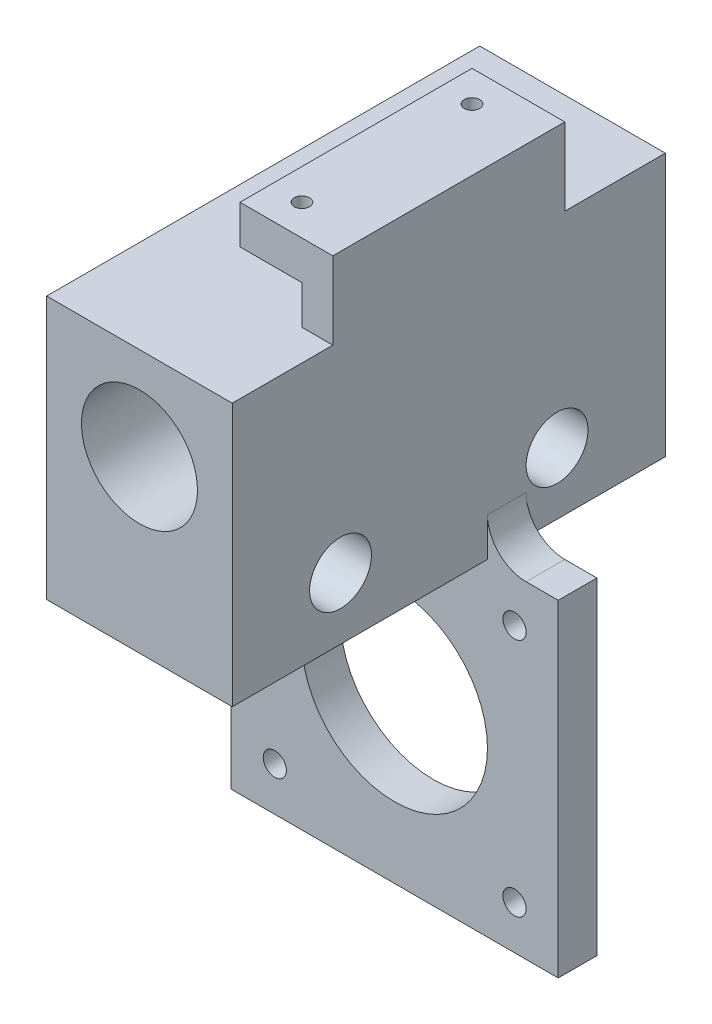
from build123d import *

# Parameters (mm, degrees)
SKETCH1_W           = 24
SKETCH1_H           = 34
SKETCH1_R           = 7.5
BOSS_EXTRUDE1_DEPTH = 28
SKETCH5_W           = 12
SKETCH5_H           = 30
BOSS_EXTRUDE3_DEPTH = 10
SKETCH6_W           = 8
SKETCH6_H           = 5
CUT_EXTRUDE3_DEPTH  = 50.769468553
CUT_EXTRUDE4_REACH  = 55.516
SKETCH7_R           = 1
SKETCH8_R           = 4
CUT_EXTRUDE5_DEPTH  = 20
SKETCH9_W           = 42.3
SKETCH9_H           = 5
BOSS_EXTRUDE4_DEPTH = 42.3
SKETCH10_R          = 12
SKETCH10_R_2        = 1.5
CUT_EXTRUDE6_DEPTH  = 48
FILLET1_R           = 5
FILLET2_R           = 5


with BuildPart() as part:
    # Sketch1 → Boss-Extrude1 (new, symmetric)
    with BuildSketch(Plane.XY):
        with Locations((0, -5)):
            Rectangle(SKETCH1_W, SKETCH1_H)
        Circle(SKETCH1_R, mode=Mode.SUBTRACT)
    extrude(amount=BOSS_EXTRUDE1_DEPTH, both=True)

    # Sketch5 → Boss-Extrude3 (add)
    with BuildSketch(Plane(origin=(0, 12, 0), x_dir=(1, 0, 0), z_dir=(0, 1, 0))):
        with Locations((6, 0)):
            Rectangle(SKETCH5_W, SKETCH5_H)
    extrude(amount=BOSS_EXTRUDE3_DEPTH)

    # Sketch6 → Cut-Extrude3 (cut, through all)
    with BuildSketch(Plane.XY.offset(15)):
        with Locations((4, 14.5)):
            Rectangle(SKETCH6_W, SKETCH6_H)
    extrude(amount=-CUT_EXTRUDE3_DEPTH, mode=Mode.SUBTRACT)

    # Sketch7 → Cut-Extrude4 (cut, up to next)
    with BuildSketch(Plane(origin=(0, 22, 0), x_dir=(1, 0, 0), z_dir=(0, 1, 0)), mode=Mode.PRIVATE) as cut_extrude4_sk1:
        with Locations(Location((4, 11, 0), (0, 0, 270))):
            Circle(SKETCH7_R)
    cut_extrude4_tool1 = extrude(cut_extrude4_sk1.sketch, amount=-CUT_EXTRUDE4_REACH, mode=Mode.PRIVATE) & part.part
    # Sketch7 → Cut-Extrude4 (cut, up to next)
    with BuildSketch(Plane(origin=(0, 22, 0), x_dir=(1, 0, 0), z_dir=(0, 1, 0)), mode=Mode.PRIVATE) as cut_extrude4_sk2:
        with Locations(Location((4, -11, 0), (0, 0, 270))):
            Circle(SKETCH7_R)
    cut_extrude4_tool2 = extrude(cut_extrude4_sk2.sketch, amount=-CUT_EXTRUDE4_REACH, mode=Mode.PRIVATE) & part.part
    add(cut_extrude4_tool1.solids().sort_by_distance((4, 22, -11))[0], mode=Mode.SUBTRACT)
    add(cut_extrude4_tool2.solids().sort_by_distance((4, 22, 11))[0], mode=Mode.SUBTRACT)

    # Sketch8 → Cut-Extrude5 (cut)
    with BuildSketch(Plane(origin=(12, 0, 0), x_dir=(0, 0, -1), z_dir=(1, 0, 0))):
        with Locations(Location((-14, -14, 0), (0, 0, 90))):
            Circle(SKETCH8_R)
        with Locations(Location((14, -14, 0), (0, 0, 90))):
            Circle(SKETCH8_R)
    extrude(amount=-CUT_EXTRUDE5_DEPTH, mode=Mode.SUBTRACT)

    # Sketch9 → Boss-Extrude4 (add)
    with BuildSketch(Plane.XZ.offset(22)):
        with Locations((0, -7.5)):
            Rectangle(SKETCH9_W, SKETCH9_H)
    extrude(amount=BOSS_EXTRUDE4_DEPTH)

    # Sketch10 → Cut-Extrude6 (cut)
    with BuildSketch(Plane(origin=(0, 0, -10), x_dir=(-1, 0, 0), z_dir=(0, 0, -1))):
        with Locations((0, -43.15)):
            Circle(SKETCH10_R)
        with Locations((-15.5, -27.65)):
            Circle(SKETCH10_R_2)
        with Locations((15.5, -27.65)):
            Circle(SKETCH10_R_2)
        with Locations((15.5, -58.65)):
            Circle(SKETCH10_R_2)
        with Locations((-15.5, -58.65)):
            Circle(SKETCH10_R_2)
    extrude(amount=-CUT_EXTRUDE6_DEPTH, mode=Mode.SUBTRACT)

    # Fillet1
    fillet1_edges = [part.edges().sort_by_distance(p)[0] for p in [
        (-12, -22, -7.5),
    ]]
    fillet(fillet1_edges, radius=FILLET1_R)

    # Fillet2
    fillet2_edges = [part.edges().sort_by_distance(p)[0] for p in [
        (12, -22, -7.5),
    ]]
    fillet(fillet2_edges, radius=FILLET2_R)


solid = part.part
